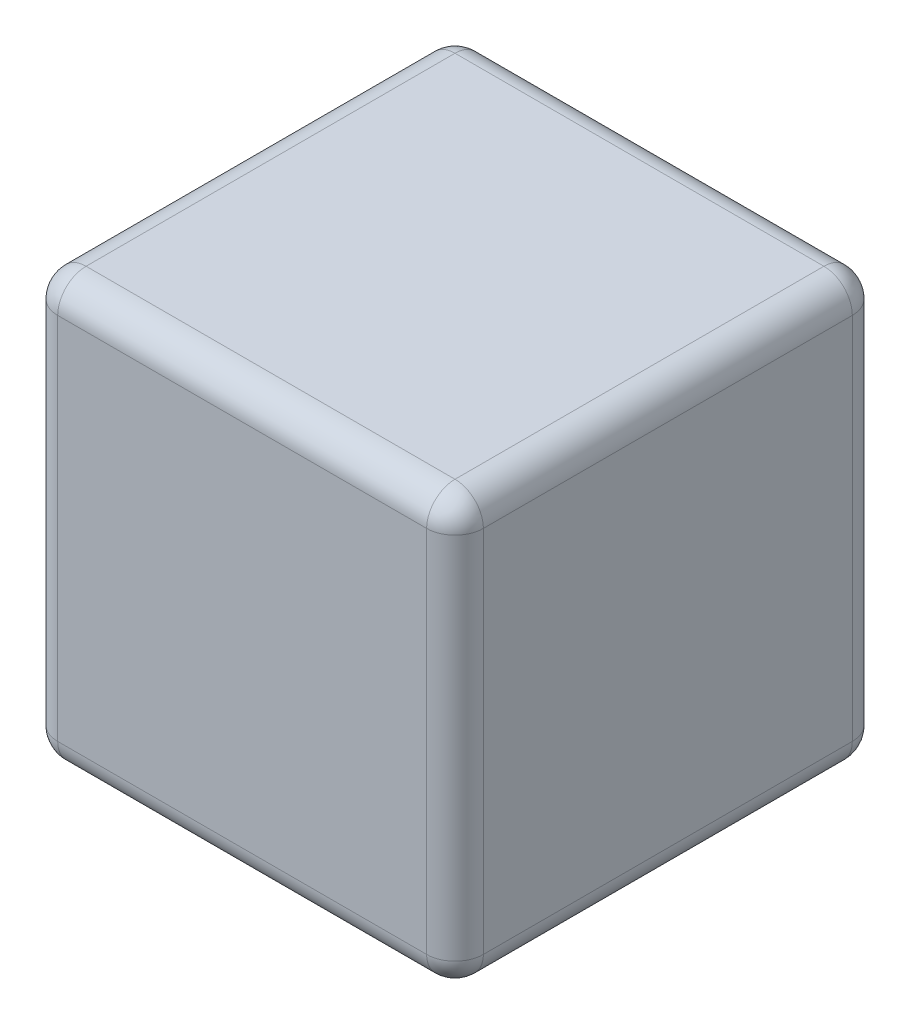
from build123d import *

# Parameters (mm, degrees)
SKETCH1_W           = 38.1
SKETCH1_H           = 38.1
BOSS_EXTRUDE1_DEPTH = 38.1
FILLET1_R           = 2.54


with BuildPart() as part:
    # Sketch1 → Boss-Extrude1 (new body)
    with BuildSketch(Plane(origin=(0, 0, 0), x_dir=(1, 0, 0), z_dir=(0, 1, 0))):
        Rectangle(SKETCH1_W, SKETCH1_H)
    extrude(amount=BOSS_EXTRUDE1_DEPTH)

    # Fillet1
    fillet1_edges = [part.edges().sort_by_distance(p)[0] for p in [
        (-19.05, 38.1, 0),
        (0, 38.1, 19.05),
        (19.05, 38.1, 0),
        (0, 0, 19.05),
        (-19.05, 0, 0),
        (0, 0, -19.05),
        (19.05, 0, 0),
        (19.05, 19.05, 19.05),
        (-19.05, 19.05, 19.05),
        (-19.05, 19.05, -19.05),
        (19.05, 19.05, -19.05),
        (0, 38.1, -19.05),
    ]]
    fillet(fillet1_edges, radius=FILLET1_R)


solid = part.part
